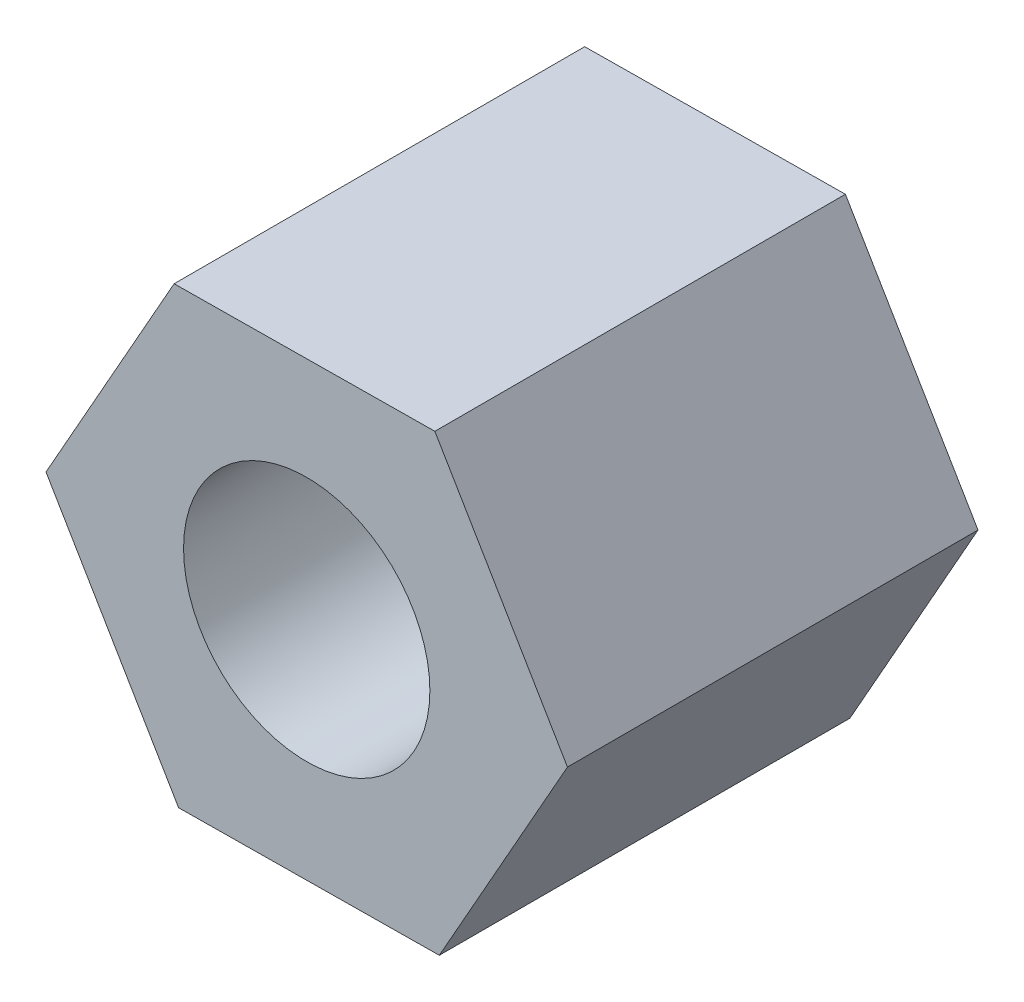
from build123d import *

# Parameters (mm, degrees)
SKETCH_1_R      = 1.5
EXTRUDE_1_DEPTH = 5


with BuildPart() as part:
    # 草图1 → 凸台-拉伸1 (new body)
    with BuildSketch(Plane.XY):
        Polygon((1.614814259, -2.734174143), (3.175271395, 0.031383099), (1.560457137, 2.765557242), (-1.614814259, 2.734174143), (-3.175271395, -0.031383099), (-1.560457137, -2.765557242), align=None)
        Circle(SKETCH_1_R, mode=Mode.SUBTRACT)
    extrude(amount=EXTRUDE_1_DEPTH)


solid = part.part
